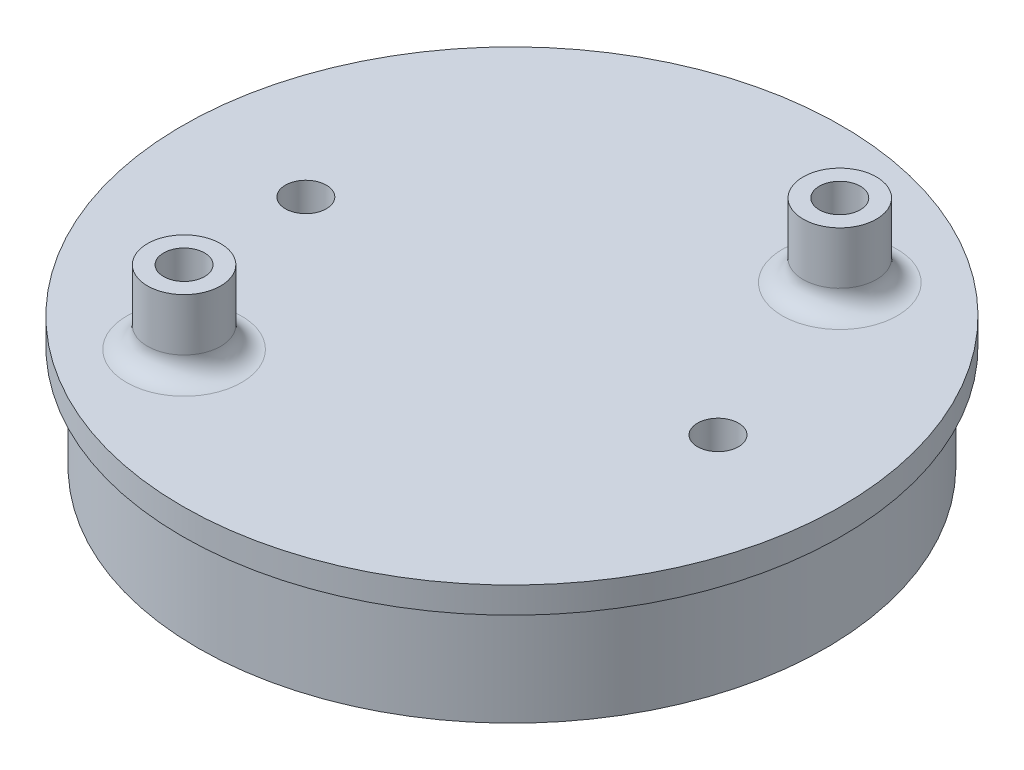
from build123d import *

# Parameters (mm, degrees)
SKETCH1_R               = 40.005
BOSS_EXTRUDE1_DEPTH     = 3.175
SKETCH1_3_R             = 38.1
BOSS_EXTRUDE2_DEPTH     = 12.7
CUT_EXTRUDE1_DEPTH      = 59.760664351
CUT_EXTRUDE1_DEPTH_BACK = 59.760664351
SKETCH3_R               = 2.4892
CUT_EXTRUDE2_DEPTH      = 59.760664351
CUT_EXTRUDE2_DEPTH_BACK = 59.760664351
SKETCH4_R               = 2.4892
BOSS_EXTRUDE3_START     = 8.89
SKETCH4_3_R             = 4.445
SKETCH4_3_R_2           = 2.4892
BOSS_EXTRUDE3_DEPTH     = 8.89
FILLET1_R               = 2.54


with BuildPart() as part:
    # Sketch1 → Boss-Extrude1 (new body)
    with BuildSketch(Plane(origin=(0, 0, 0), x_dir=(1, 0, 0), z_dir=(0, 1, 0))):
        Circle(SKETCH1_R)
    extrude(amount=BOSS_EXTRUDE1_DEPTH)

    # Sketch1<3> → Boss-Extrude2 (add)
    with BuildSketch(Plane(origin=(0, 0, 0), x_dir=(1, 0, 0), z_dir=(0, 1, 0))):
        Circle(SKETCH1_3_R)
    extrude(amount=-BOSS_EXTRUDE2_DEPTH)

    # Sketch3 → Cut-Extrude1 (cut, two sides: drawn at the far end of the back side and taken through both)
    with BuildSketch(Plane(origin=(0, 3.175, 0), x_dir=(1, 0, 0), z_dir=(0, 1, 0)).offset(-CUT_EXTRUDE1_DEPTH_BACK)):
        with Locations((-25.015, 0)):
            Circle(SKETCH3_R)
        with Locations((25.015, 0)):
            Circle(SKETCH3_R)
    extrude(amount=CUT_EXTRUDE1_DEPTH + CUT_EXTRUDE1_DEPTH_BACK, mode=Mode.SUBTRACT)

    # Sketch4 → Cut-Extrude2 (cut, two sides: drawn at the far end of the back side and taken through both)
    with BuildSketch(Plane(origin=(0, 3.175, 0), x_dir=(1, 0, 0), z_dir=(0, 1, 0)).offset(-CUT_EXTRUDE2_DEPTH_BACK)):
        with Locations((16.389946669, 23.407269666)):
            Circle(SKETCH4_R)
        with Locations((-16.389946669, -23.407269666)):
            Circle(SKETCH4_R)
    extrude(amount=CUT_EXTRUDE2_DEPTH + CUT_EXTRUDE2_DEPTH_BACK, mode=Mode.SUBTRACT)

    # Sketch4<3> → Boss-Extrude3 (add)
    # profile 1 of 2: a face of its own
    with BuildSketch(Plane(origin=(0, 3.175, 0), x_dir=(1, 0, 0), z_dir=(0, 1, 0)).offset(BOSS_EXTRUDE3_START)):
        with Locations((16.389946669, 23.407269666)):
            Circle(SKETCH4_3_R)
        with Locations((16.389946669, 23.407269666)):
            Circle(SKETCH4_3_R_2, mode=Mode.SUBTRACT)
    # profile 2 of 2: a face of its own
    with BuildSketch(Plane(origin=(0, 3.175, 0), x_dir=(1, 0, 0), z_dir=(0, 1, 0)).offset(BOSS_EXTRUDE3_START)):
        with Locations((-16.389946669, -23.407269666)):
            Circle(SKETCH4_3_R)
        with Locations((-16.389946669, -23.407269666)):
            Circle(SKETCH4_3_R_2, mode=Mode.SUBTRACT)
    extrude(amount=-BOSS_EXTRUDE3_DEPTH)

    # Fillet1
    fillet1_edges = [part.edges().sort_by_distance(p)[0] for p in [
        (11.944946669, 3.175, -23.407269666),
        (-20.834946669, 3.175, 23.407269666),
    ]]
    fillet(fillet1_edges, radius=FILLET1_R)


solid = part.part
